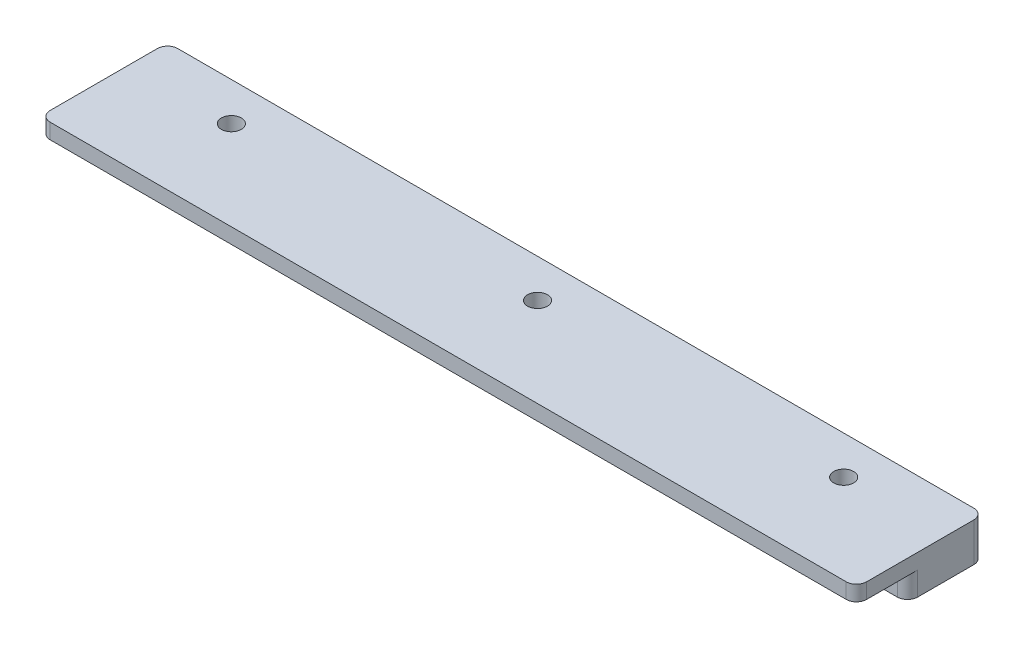
from build123d import *

# Parameters (mm, degrees)
EXTRUDE_1_DEPTH     = 160
CUT_EXTRUDE_1_REACH = 164.12
SKETCH_2_R          = 1.95
FILLET_1_R          = 2


with BuildPart() as part:
    # 草图1 → 凸台-拉伸1 (new body)
    with BuildSketch(Plane(origin=(0, 0, 0), x_dir=(0, 0, -1), z_dir=(1, 0, 0))):
        Polygon((0, 0), (0, 7.6), (-25, 7.6), (-25, 4.6), (-15, 4.6), (-15, 0), align=None)
    extrude(amount=EXTRUDE_1_DEPTH)

    # 草图2 → 切除-拉伸1 (cut, up to next)
    with BuildSketch(Plane.XZ, mode=Mode.PRIVATE) as cut_extrude_1_sk1:
        with Locations(Location((20, 7.5, 0), (0, 0, 270))):
            Circle(SKETCH_2_R)
    cut_extrude_1_tool1 = extrude(cut_extrude_1_sk1.sketch, amount=-CUT_EXTRUDE_1_REACH, mode=Mode.PRIVATE) & part.part
    # 草图2 → 切除-拉伸1 (cut, up to next)
    with BuildSketch(Plane.XZ, mode=Mode.PRIVATE) as cut_extrude_1_sk2:
        with Locations(Location((140, 7.5, 0), (0, 0, 270))):
            Circle(SKETCH_2_R)
    cut_extrude_1_tool2 = extrude(cut_extrude_1_sk2.sketch, amount=-CUT_EXTRUDE_1_REACH, mode=Mode.PRIVATE) & part.part
    # 草图2 → 切除-拉伸1 (cut, up to next)
    with BuildSketch(Plane.XZ, mode=Mode.PRIVATE) as cut_extrude_1_sk3:
        with Locations(Location((80, 7.5, 0), (0, 0, 270))):
            Circle(SKETCH_2_R)
    cut_extrude_1_tool3 = extrude(cut_extrude_1_sk3.sketch, amount=-CUT_EXTRUDE_1_REACH, mode=Mode.PRIVATE) & part.part
    add(cut_extrude_1_tool1.solids().sort_by_distance((20, 0, 7.5))[0], mode=Mode.SUBTRACT)
    add(cut_extrude_1_tool2.solids().sort_by_distance((140, 0, 7.5))[0], mode=Mode.SUBTRACT)
    add(cut_extrude_1_tool3.solids().sort_by_distance((80, 0, 7.5))[0], mode=Mode.SUBTRACT)

    # 圆角1
    fillet_1_edges = [part.edges().sort_by_distance(p)[0] for p in [
        (160, 6.1, 25),
        (160, 2.3, 15),
        (0, 2.3, 15),
        (0, 6.1, 25),
        (0, 3.8, 0),
        (160, 3.8, 0),
    ]]
    fillet(fillet_1_edges, radius=FILLET_1_R)


solid = part.part
